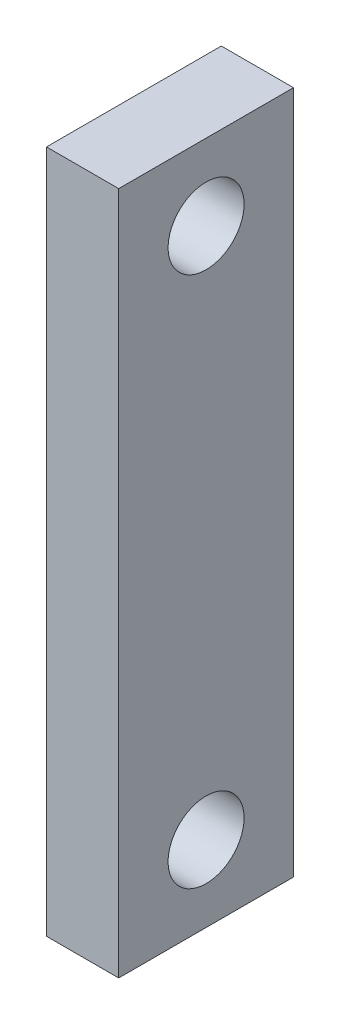
from build123d import *

# Parameters (mm, degrees)
SKETCH1_W           = 95
SKETCH1_H           = 230
BOSS_EXTRUDE1_DEPTH = 899.573333333
SKETCH2_R           = 50
CUT_EXTRUDE1_DEPTH  = 1200
SKETCH5_R           = 50
CUT_EXTRUDE4_DEPTH  = 226
SCALE1_SCALE        = 0.75


with BuildPart() as part:
    # Sketch1 → Boss-Extrude1 (new body)
    with BuildSketch(Plane(origin=(0, 0, 0), x_dir=(1, 0, 0), z_dir=(0, 1, 0))):
        Rectangle(SKETCH1_W, SKETCH1_H)
    extrude(amount=BOSS_EXTRUDE1_DEPTH)

    # Sketch2 → Cut-Extrude1 (cut)
    with BuildSketch(Plane(origin=(47.5, 0, 0), x_dir=(0, 0, -1), z_dir=(1, 0, 0))):
        with Locations((0, 799.573333333)):
            Circle(SKETCH2_R)
    extrude(amount=-CUT_EXTRUDE1_DEPTH, mode=Mode.SUBTRACT)

    # Sketch5 → Cut-Extrude4 (cut)
    with BuildSketch(Plane(origin=(47.5, 0, 0), x_dir=(0, 0, -1), z_dir=(1, 0, 0))):
        with Locations((0, 100)):
            Circle(SKETCH5_R)
    extrude(amount=-CUT_EXTRUDE4_DEPTH, mode=Mode.SUBTRACT)


with BuildPart() as part_1:
    # Scale1: scaled about (0, 449.786666667, 0)
    add(part.part.scale(SCALE1_SCALE).moved(Location((0, 112.446666667, 0))))


solid = part_1.part
